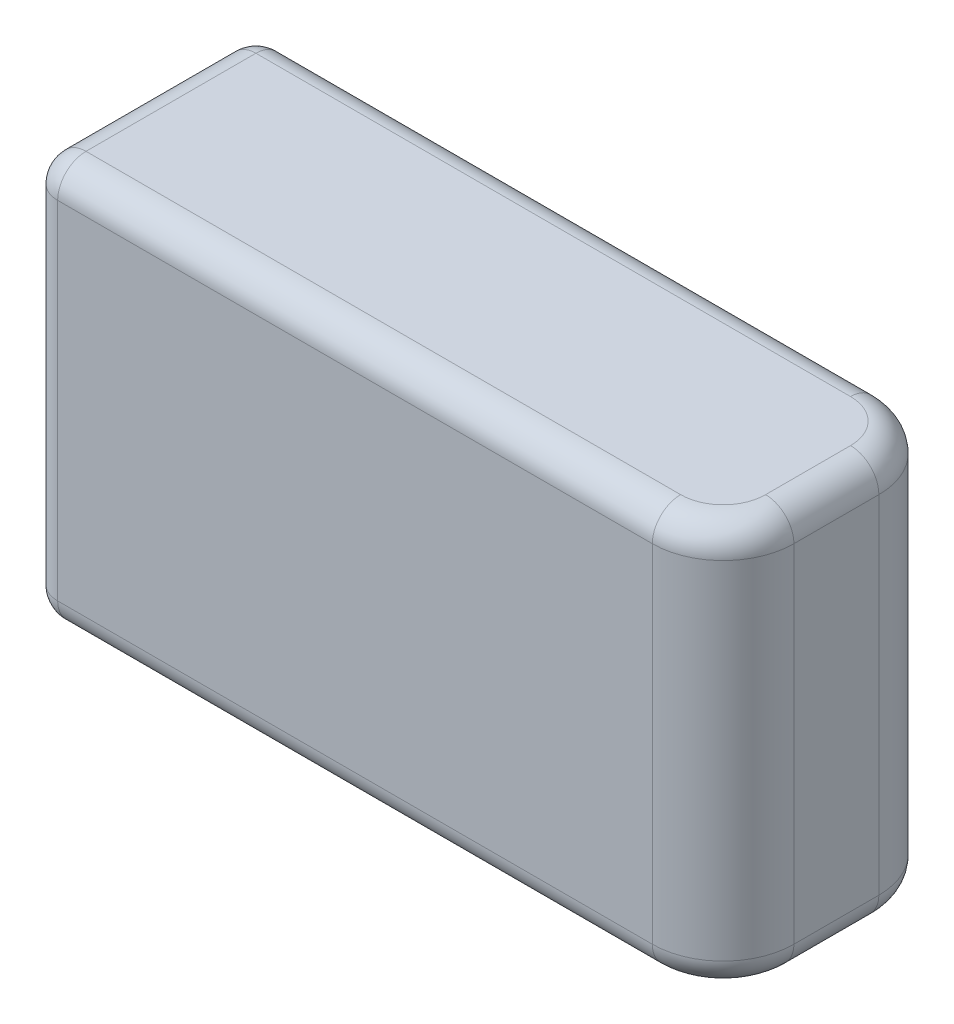
from build123d import *

# Parameters (mm, degrees)
SKETCH1_W           = 41.5
SKETCH1_H           = 28.5
SKETCH1_W_2         = 7.5
BOSS_EXTRUDE1_DEPTH = 16
FILLET2_R           = 5
FILLET3_R           = 2


with BuildPart() as part:
    # Sketch1 → Boss-Extrude1 (new body)
    with BuildSketch(Plane.XY):
        with Locations((3.75, 0)):
            Rectangle(SKETCH1_W, SKETCH1_H)
        with Locations((-20.75, 0)):
            Rectangle(SKETCH1_W_2, SKETCH1_H)
    extrude(amount=BOSS_EXTRUDE1_DEPTH)

    # Fillet2
    fillet2_edges = [part.edges().sort_by_distance(p)[0] for p in [
        (24.5, 0, 16),
        (24.5, 0, 0),
    ]]
    fillet(fillet2_edges, radius=FILLET2_R)

    # Fillet3
    fillet3_edges = [part.edges().sort_by_distance(p)[0] for p in [
        (-2.5, -14.25, 16),
        (24.5, 14.25, 8),
        (24.5, -14.25, 8),
        (23.035533906, -14.25, 1.464466094),
        (23.035533906, -14.25, 14.535533906),
        (23.035533906, 14.25, 1.464466094),
        (23.035533906, 14.25, 14.535533906),
        (-2.5, 14.25, 16),
        (-2.5, -14.25, 0),
        (-24.5, 0, 0),
        (-2.5, 14.25, 0),
        (-24.5, 0, 16),
        (-24.5, -14.25, 8),
        (-24.5, 14.25, 8),
    ]]
    fillet(fillet3_edges, radius=FILLET3_R)


solid = part.part
